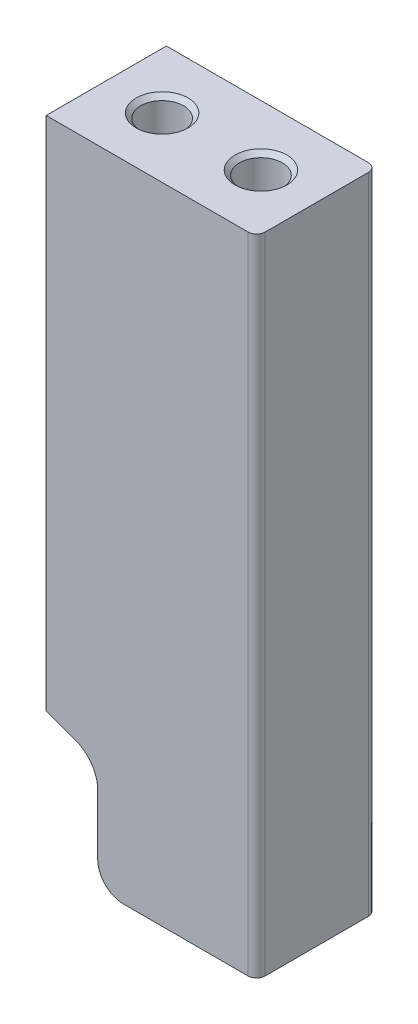
from build123d import *

# Parameters (mm, degrees)
SKETCH1_W                   = 24.5
SKETCH1_H                   = 14
BOSS_EXTRUDE1_DEPTH         = 75
CUT_EXTRUDE1_REACH          = 79.273
FILLET1_R                   = 3
FILLET2_R                   = 1
M6_TAPPED_HOLE1_D           = 5
M6_TAPPED_HOLE1_DEPTH       = 17
M6_TAPPED_HOLE1_CSINK_D     = 6.05
M6_TAPPED_HOLE1_CSINK_ANGLE = 90
M6_TAPPED_HOLE1_TIP         = 1.502151548


with BuildPart() as part:
    # Sketch1 → Boss-Extrude1 (new body)
    with BuildSketch(Plane(origin=(0, 0, 0), x_dir=(1, 0, 0), z_dir=(0, 1, 0))):
        Rectangle(SKETCH1_W, SKETCH1_H)
    extrude(amount=-BOSS_EXTRUDE1_DEPTH)

    # Sketch2 → Cut-Extrude1 (cut, up to next)
    with BuildSketch(Plane.XY.offset(7), mode=Mode.PRIVATE) as cut_extrude1_sk1:
        with BuildLine():
            Line((-8.881919427, -61.241229517), (-12.25, -60.015348442))
            Line((-12.25, -60.015348442), (-12.25, -75))
            Line((-12.25, -75), (-6.25, -75))
            Line((-6.25, -75), (-6.25, -65))
            ThreePointArc((-6.25, -65), (-6.973391823, -62.705694255), (-8.881919427, -61.241229517))
        make_face()
    cut_extrude1_tool1 = extrude(cut_extrude1_sk1.sketch, amount=-CUT_EXTRUDE1_REACH, mode=Mode.PRIVATE) & part.part
    add(cut_extrude1_tool1.solids().sort_by_distance((-9.372504, -68.134359, 7))[0], mode=Mode.SUBTRACT)

    # Fillet1
    fillet1_edges = [part.edges().sort_by_distance(p)[0] for p in [
        (-6.25, -75, 0),
    ]]
    fillet(fillet1_edges, radius=FILLET1_R)

    # Fillet2
    fillet2_edges = [part.edges().sort_by_distance(p)[0] for p in [
        (12.25, -37.5, 7),
        (12.25, -37.5, -7),
    ]]
    fillet(fillet2_edges, radius=FILLET2_R)

    # M6 Tapped Hole1
    with Locations(Plane(origin=(0, 0, 0), x_dir=(1, 0, 0), z_dir=(0, 1, 0))):
        with Locations((-5.75, 0), (5.75, 0)):
            CounterSinkHole(M6_TAPPED_HOLE1_D / 2, M6_TAPPED_HOLE1_CSINK_D / 2, depth=M6_TAPPED_HOLE1_DEPTH, counter_sink_angle=M6_TAPPED_HOLE1_CSINK_ANGLE)
            with Locations((0, 0, -(M6_TAPPED_HOLE1_DEPTH + M6_TAPPED_HOLE1_TIP / 2))):  # 118° drill point
                Cone(0, M6_TAPPED_HOLE1_D / 2, M6_TAPPED_HOLE1_TIP, mode=Mode.SUBTRACT)


solid = part.part
